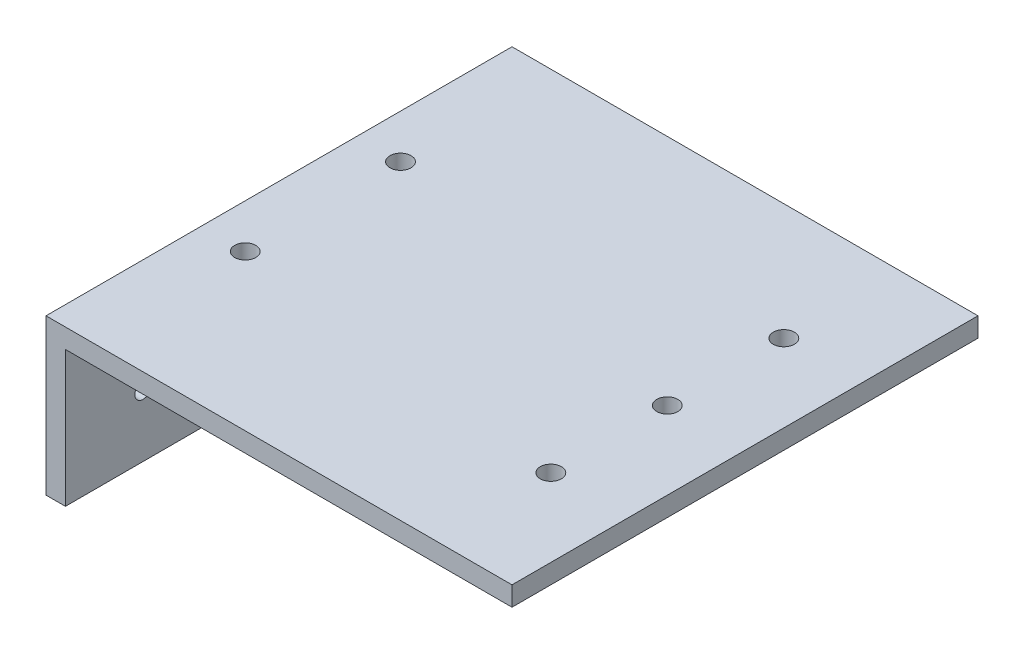
from build123d import *

# Parameters (mm, degrees)
BOSS_EXTRUDE1_DEPTH       = 76.2
CUT_EXTRUDE1_REACH        = 112.716
SKETCH7_R                 = 3.175
TAP_DRILL_FOR_8_32_TAP2_D = 3.4544
TAP_DRILL_FOR_8_32_TAP4_D = 3.4544
TAP_DRILL_FOR_6_32_TAP1_D = 2.7051


with BuildPart() as part:
    # Sketch2 → Boss-Extrude1 (new body)
    with BuildSketch(Plane.XY):
        Polygon((0, 0), (-76.2, 0), (-76.2, -25.4), (-73.025, -25.4), (-73.025, -3.175), (0, -3.175), align=None)
    extrude(amount=BOSS_EXTRUDE1_DEPTH)

    # Sketch7 → Cut-Extrude1 (cut, up to next)
    with BuildSketch(Plane.ZY.offset(76.2), mode=Mode.PRIVATE) as cut_extrude1_sk1:
        with Locations((38.1, -15.24)):
            Circle(SKETCH7_R)
    cut_extrude1_tool1 = extrude(cut_extrude1_sk1.sketch, amount=-CUT_EXTRUDE1_REACH, mode=Mode.PRIVATE) & part.part
    add(cut_extrude1_tool1.solids().sort_by_distance((-76.2, -15.24, 38.1))[0], mode=Mode.SUBTRACT)

    # Tap Drill for #8-32 Tap2 (through all)
    with Locations(Plane(origin=(0, 0, 0), x_dir=(1, 0, 0), z_dir=(0, 1, 0))):
        with Locations((-12.7, -19.05), (-12.7, -38.1), (-12.7, -57.15)):
            Hole(TAP_DRILL_FOR_8_32_TAP2_D / 2)

    # Tap Drill for #8-32 Tap4 (through all)
    with Locations(Plane(origin=(0, 0, 0), x_dir=(1, 0, 0), z_dir=(0, 1, 0))):
        with Locations((-69.028514561, -25.4), (-69.028514561, -50.8)):
            Hole(TAP_DRILL_FOR_8_32_TAP4_D / 2)

    # Tap Drill for #6-32 Tap1 (through all)
    with Locations(Plane.ZY.offset(76.2)):
        with Locations((50.8, -15.24), (63.5, -15.24)):
            Hole(TAP_DRILL_FOR_6_32_TAP1_D / 2)


solid = part.part
